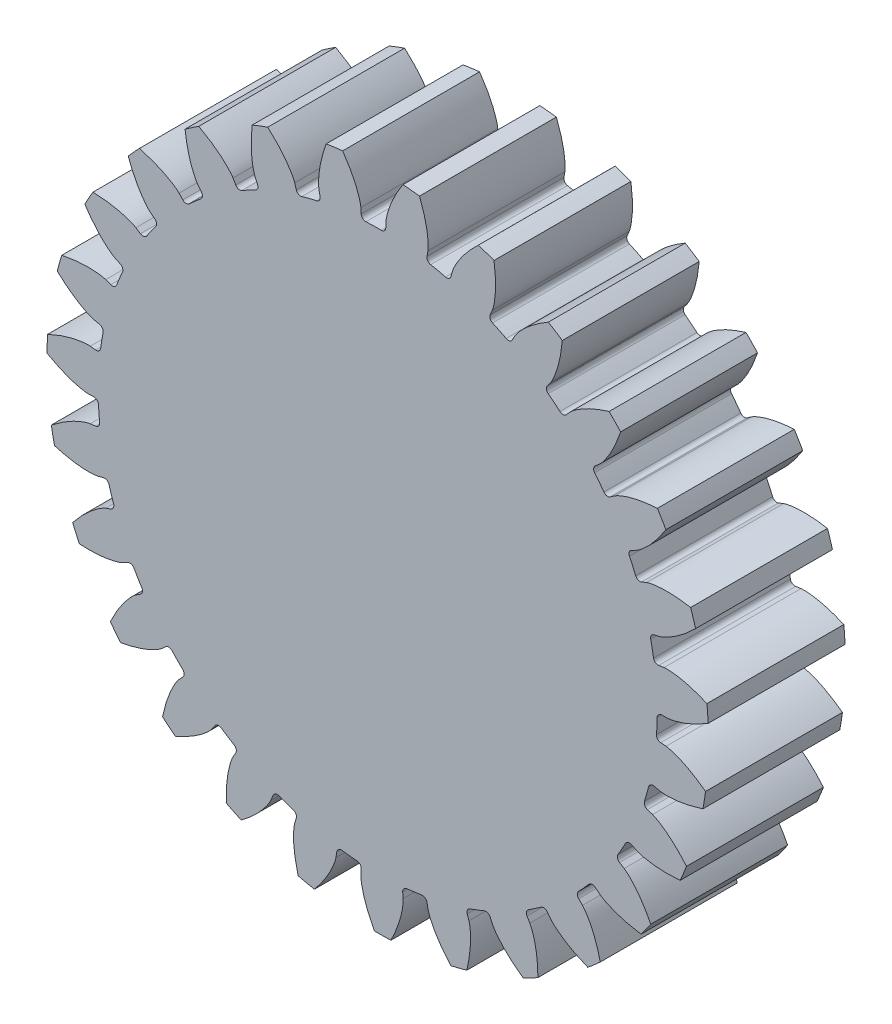
from build123d import *

# Parameters (mm, degrees)
SKETCH1_R                 = 7.25
BOSS_EXTRUDE1_DEPTH       = 3
CUT_EXTRUDE1_DEPTH        = 11.68293031
FILLET1_R                 = 0.1
FILLET2_R                 = 0.1
CIRPATTERN14_COUNT        = 27
FILLET1_OF_CIRPATTERN14_R = 0.1
FILLET2_OF_CIRPATTERN14_R = 0.1


with BuildPart() as part:
    # Sketch1 → Boss-Extrude1 (new body)
    with BuildSketch(Plane.XY):
        Circle(SKETCH1_R)
    extrude(amount=BOSS_EXTRUDE1_DEPTH)

    # Sketch3 → Cut-Extrude1 (cut, symmetric)
    with BuildSketch(Plane.XY):
        with BuildLine():
            Line((6.34292519, 0), (6.125, 0))
            ThreePointArc((6.125, 0), (6.119266134, -0.264965992), (6.102075273, -0.529435892))
            Line((6.102075273, -0.529435892), (6.31918481, -0.548273021))
            add(Edge.make_bspline(
                [(6.31918481, -0.548273021), (6.321342351, -0.54849153), (6.327383846, -0.549200504), (6.345975445, -0.552009807), (6.382417591, -0.559290703), (6.427009257, -0.570765396), (6.477828124, -0.586319481), (6.526461509, -0.603178109), (6.567770361, -0.618732734), (6.608707339, -0.635305555), (6.649231899, -0.65276424), (6.698000566, -0.675027935), (6.756022956, -0.703271548), (6.823130602, -0.738519359), (6.89836478, -0.781120059), (6.974039751, -0.827312942), (7.047659749, -0.875038465), (7.11001768, -0.918224097), (7.152541616, -0.948795144), (7.177380092, -0.96716289), (7.18448503, -0.972458148)],
                knots=[0, 0, 0, 0, 0, 0.005376749, 0.015083688, 0.04661014, 0.092110525, 0.119476176, 0.146842496, 0.174208854, 0.201574956, 0.228941013, 0.256307345, 0.307035032, 0.361767352, 0.416499661, 0.471231937, 0.525964282, 0.580696616, 0.602617834, 0.602617834, 0.602617834, 0.602617834, 0.602617834], degree=4))
            ThreePointArc((7.18448503, -0.972458148), (7.233602715, -0.487331268), (7.25, 0))
            ThreePointArc((7.25, 0), (7.247912871, 0.173951185), (7.241652686, 0.347802217))
            add(Edge.make_bspline(
                [(6.34292519, 0), (6.345093544, 3.1196e-05), (6.351173709, 0.000215298), (6.369938555, 0.001407057), (6.406873655, 0.005510697), (6.452290278, 0.013088005), (6.504263411, 0.024191167), (6.554172006, 0.036782899), (6.596670765, 0.04870863), (6.638887053, 0.061680891), (6.68076904, 0.075571348), (6.731279617, 0.093536223), (6.791526175, 0.116658756), (6.861429418, 0.145973956), (6.94006435, 0.18191208), (7.019448928, 0.221390839), (7.096918703, 0.262574131), (7.162776142, 0.300208), (7.207783435, 0.326988921), (7.234116626, 0.343140919), (7.241652686, 0.347802217)],
                knots=[0, 0, 0, 0, 0, 0.005376749, 0.015083688, 0.04661014, 0.092110525, 0.119476176, 0.146842496, 0.174208854, 0.201574956, 0.228941013, 0.256307345, 0.307035032, 0.361767352, 0.416499661, 0.471231937, 0.525964282, 0.580696616, 0.602617834, 0.602617834, 0.602617834, 0.602617834, 0.602617834], degree=4))
        make_face()
    cut_extrude1 = extrude(amount=CUT_EXTRUDE1_DEPTH, both=True, mode=Mode.SUBTRACT)

    # Fillet1
    fillet1_edges = [part.edges().sort_by_distance(p)[0] for p in [
        (6.102075273, -0.529435892, 1.5),
    ]]
    fillet(fillet1_edges, radius=FILLET1_R)

    # Fillet2
    fillet2_edges = [part.edges().sort_by_distance(p)[0] for p in [
        (6.125, 0, 1.5),
    ]]
    fillet(fillet2_edges, radius=FILLET2_R)

    # CirPattern14: Cut-Extrude1 ×27 about axis
    cirpattern14_axis = Axis((0, 0, 3), (0, 0, -1))
    for i in range(1, CIRPATTERN14_COUNT):
        add(cut_extrude1.rotate(cirpattern14_axis, i * 360 / CIRPATTERN14_COUNT), mode=Mode.SUBTRACT)

    # Fillet1 of CirPattern14
    fillet1_of_cirpattern14_edges = [part.edges().sort_by_distance(p)[0] for p in [
        (5.815496725, -1.922400281, 1.5),
        (5.215403243, -3.211727574, 1.5),
        (4.334146023, -4.327909802, 1.5),
        (3.219233868, -5.210773292, 1.5),
        (1.930771983, -5.812722645, 1.5),
        (0.53822168, -6.101306616, 1.5),
        (-0.883344293, -6.060967568, 1.5),
        (-2.257288946, -5.693880189, 1.5),
        (-3.509542569, -5.019834256, 1.5),
        (-4.572595842, -4.075167759, 1.5),
        (-5.389139291, -2.910807913, 1.5),
        (-5.915152845, -1.589525659, 1.5),
        (-6.122278978, -0.182551665, 1.5),
        (-5.999351467, 1.234263736, 1.5),
        (-5.552997366, 2.58453966, 1.5),
        (-4.807279739, 3.795482382, 1.5),
        (-3.802400417, 4.801809666, 1.5),
        (-2.592532704, 5.549270148, 1.5),
        (-1.242900883, 5.99756804, 1.5),
        (0.173736047, 6.122535487, 1.5),
        (1.581006822, 5.91743546, 1.5),
        (2.90304511, 5.393324957, 1.5),
        (4.068579484, 4.578458909, 1.5),
        (5.014775686, 3.516766956, 1.5),
        (5.690624032, 2.265485186, 1.5),
        (6.059689363, 0.892070523, 1.5),
    ]]
    fillet(fillet1_of_cirpattern14_edges, radius=FILLET1_OF_CIRPATTERN14_R)

    # Fillet2 of CirPattern14
    fillet2_of_cirpattern14_edges = [part.edges().sort_by_distance(p)[0] for p in [
        (5.959899832, -1.412522208, 1.5),
        (5.473499922, -2.748894979, 1.5),
        (4.692022214, -3.937074109, 1.5),
        (3.657596374, -4.913004556, 1.5),
        (2.425988567, -5.624073655, 1.5),
        (1.063595088, -6.031947487, 1.5),
        (-0.356137077, -6.114637469, 1.5),
        (-1.7566698, -5.867685763, 1.5),
        (-3.0625, -5.304405598, 1.5),
        (-4.203230032, -4.455163555, 1.5),
        (-5.117362845, -3.365742491, 1.5),
        (-5.755617302, -2.094873378, 1.5),
        (-6.083584941, -0.711069099, 1.5),
        (-6.083584941, 0.711069099, 1.5),
        (-5.755617302, 2.094873378, 1.5),
        (-5.117362845, 3.365742491, 1.5),
        (-4.203230032, 4.455163555, 1.5),
        (-3.0625, 5.304405598, 1.5),
        (-1.7566698, 5.867685763, 1.5),
        (-0.356137077, 6.114637469, 1.5),
        (1.063595088, 6.031947487, 1.5),
        (2.425988567, 5.624073655, 1.5),
        (3.657596374, 4.913004556, 1.5),
        (4.692022214, 3.937074109, 1.5),
        (5.473499922, 2.748894979, 1.5),
        (5.959899832, 1.412522208, 1.5),
    ]]
    fillet(fillet2_of_cirpattern14_edges, radius=FILLET2_OF_CIRPATTERN14_R)


solid = part.part
